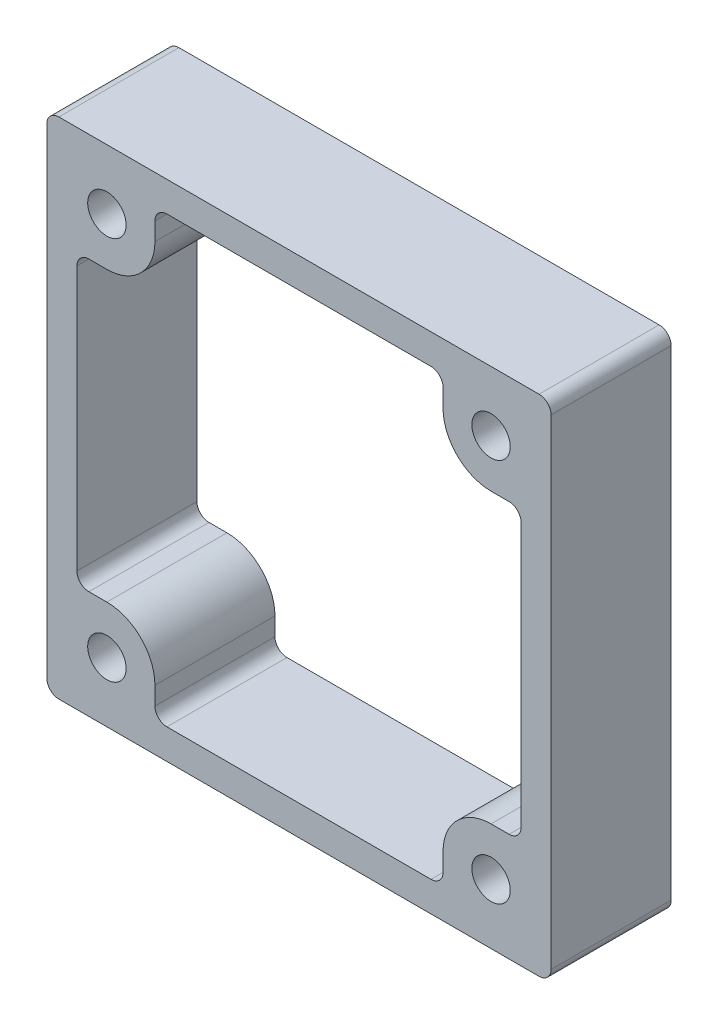
from build123d import *

# Parameters (mm, degrees)
SKETCH1_R           = 1.6
BOSS_EXTRUDE1_DEPTH = 10


with BuildPart() as part:
    # Sketch1 → Boss-Extrude1 (new body)
    with BuildSketch(Plane.XY):
        with BuildLine():
            Line((0, -1), (40, -1))
            ThreePointArc((40, -1), (40.707106781, -0.707106781), (41, 0))
            Line((41, 0), (41, 40))
            ThreePointArc((41, 40), (40.707106781, 40.707106781), (40, 41))
            Line((40, 41), (0, 41))
            ThreePointArc((0, 41), (-0.707106781, 40.707106781), (-1, 40))
            Line((-1, 40), (-1, 0))
            ThreePointArc((-1, 0), (-0.707106781, -0.707106781), (0, -1))
        make_face()
        with Locations((4, 36)):
            Circle(SKETCH1_R, mode=Mode.SUBTRACT)
        with Locations((36, 36)):
            Circle(SKETCH1_R, mode=Mode.SUBTRACT)
        with Locations((36, 4)):
            Circle(SKETCH1_R, mode=Mode.SUBTRACT)
        with Locations((4, 4)):
            Circle(SKETCH1_R, mode=Mode.SUBTRACT)
        with BuildLine():
            Line((36, 8), (37.5, 8))
            ThreePointArc((37.5, 8), (38.207106781, 8.292893219), (38.5, 9))
            Line((38.5, 9), (38.5, 31))
            ThreePointArc((38.5, 31), (38.207106781, 31.707106781), (37.5, 32))
            Line((37.5, 32), (36, 32))
            ThreePointArc((36, 32), (33.171572875, 33.171572875), (32, 36))
            Line((32, 36), (32, 37.5))
            ThreePointArc((32, 37.5), (31.707106781, 38.207106781), (31, 38.5))
            Line((31, 38.5), (9, 38.5))
            ThreePointArc((9, 38.5), (8.292893219, 38.207106781), (8, 37.5))
            Line((8, 37.5), (8, 36))
            ThreePointArc((8, 36), (6.828427125, 33.171572875), (4, 32))
            Line((4, 32), (2.5, 32))
            ThreePointArc((2.5, 32), (1.792893219, 31.707106781), (1.5, 31))
            Line((1.5, 31), (1.5, 9))
            ThreePointArc((1.5, 9), (1.792893219, 8.292893219), (2.5, 8))
            Line((2.5, 8), (4, 8))
            ThreePointArc((4, 8), (6.828427125, 6.828427125), (8, 4))
            Line((8, 4), (8, 2.5))
            ThreePointArc((8, 2.5), (8.292893219, 1.792893219), (9, 1.5))
            Line((9, 1.5), (31, 1.5))
            ThreePointArc((31, 1.5), (31.707106781, 1.792893219), (32, 2.5))
            Line((32, 2.5), (32, 4))
            ThreePointArc((32, 4), (33.171572875, 6.828427125), (36, 8))
        make_face(mode=Mode.SUBTRACT)
    extrude(amount=BOSS_EXTRUDE1_DEPTH)


solid = part.part
